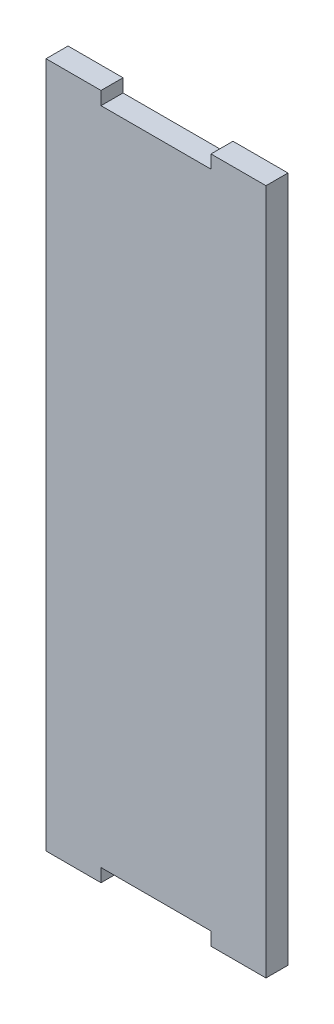
from build123d import *

# Parameters (mm, degrees)
SKETCH1_W               = 50
SKETCH1_H               = 156
BOSS_EXTRUDE1_DEPTH     = 5
CUT_EXTRUDE1_DEPTH      = 22.86
CUT_EXTRUDE1_DEPTH_BACK = 20.32
SKETCH2_W               = 25
SKETCH2_H               = 3


with BuildPart() as part:
    # Sketch1 → Boss-Extrude1 (new body)
    with BuildSketch(Plane.XY):
        Rectangle(SKETCH1_W, SKETCH1_H)
    extrude(amount=BOSS_EXTRUDE1_DEPTH)

    # Sketch2 → Cut-Extrude1 (cut, two sides: drawn at the far end of the back side and taken through both)
    with BuildSketch(Plane.XY.offset(5).offset(-CUT_EXTRUDE1_DEPTH_BACK)):
        with Locations((0, 76.5)):
            Rectangle(SKETCH2_W, SKETCH2_H)
        with Locations((0, -76.5)):
            Rectangle(SKETCH2_W, SKETCH2_H)
    extrude(amount=CUT_EXTRUDE1_DEPTH + CUT_EXTRUDE1_DEPTH_BACK, mode=Mode.SUBTRACT)


solid = part.part
